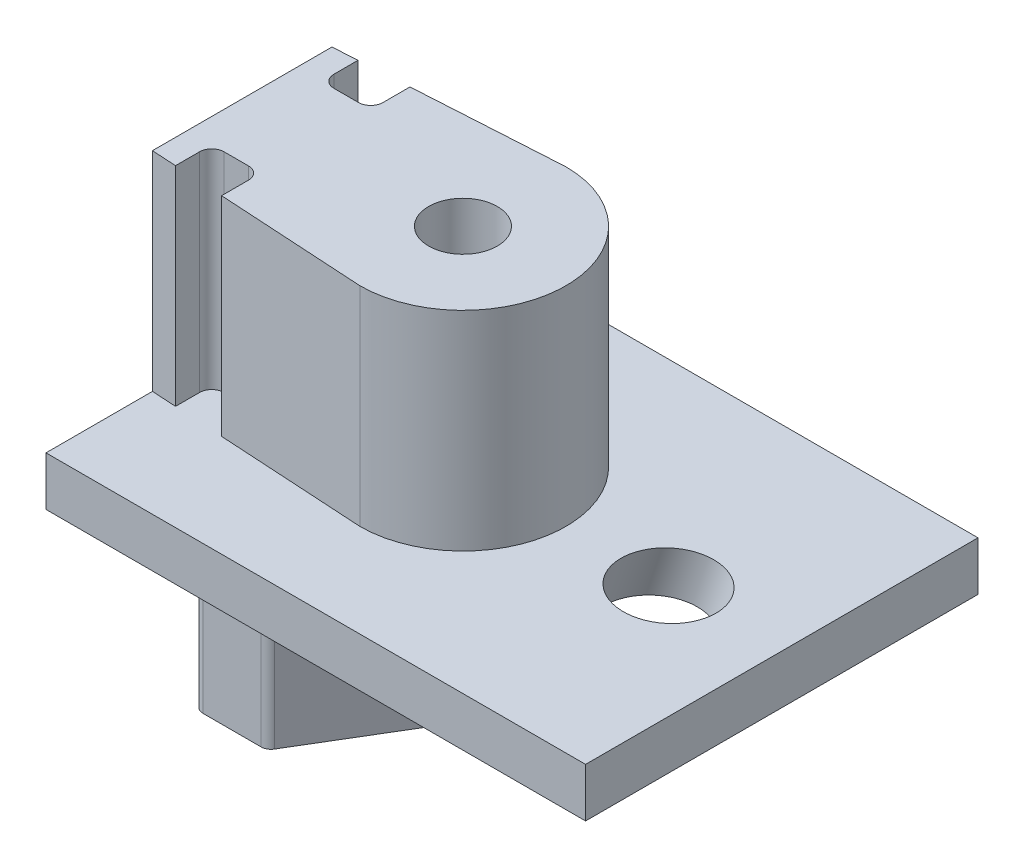
from build123d import *

# Parameters (mm, degrees)
BOSS_EXTRUDE1_DEPTH     = 2.125
SKETCH4_R               = 0.35
THROUGH_HOLES_DEPTH     = 4.445014514
FILLET1_R               = 0.125
SKETCH5_R               = 0.125
BOSS_EXTRUDE2_DEPTH     = 0.5
SKETCH8_R               = 0.46
CUT_EXTRUDE1_DEPTH      = 5.582575695
CUT_EXTRUDE2_DEPTH      = 5.367851302
CUT_EXTRUDE2_DEPTH_BACK = 5.367851302
SKETCH9_W               = 1.465031661
SKETCH9_H               = 4
BOSS_EXTRUDE3_DEPTH     = 1.75
FILLET2_R               = 0.1


with BuildPart() as part:
    # Sketch3 → Boss-Extrude1 (new body)
    with BuildSketch(Plane(origin=(0, 0, 0), x_dir=(1, 0, 0), z_dir=(0, 1, 0))):
        with BuildLine():
            Line((-2.5, 0.9), (-2, 0.93))
            Line((-2, 0.93), (-2, 0.56))
            Line((-2, 0.56), (-1.5, 0.56))
            Line((-1.5, 0.56), (-1.5, 0.96))
            Line((-1.5, 0.96), (0, 1.05))
            ThreePointArc((0, 1.05), (1.05, 0), (0, -1.05))
            Line((0, -1.05), (-1.5, -0.96))
            Line((-1.5, -0.96), (-1.5, -0.56))
            Line((-1.5, -0.56), (-2, -0.56))
            Line((-2, -0.56), (-2, -0.93))
            Line((-2, -0.93), (-2.5, -0.9))
            Line((-2.5, -0.9), (-2.5, 0.9))
        make_face()
    extrude(amount=BOSS_EXTRUDE1_DEPTH)

    # Sketch4 → Through Holes (cut, through all)
    with BuildSketch(Plane(origin=(0, 2.125, 0), x_dir=(1, 0, 0), z_dir=(0, 1, 0))):
        with Locations(Location((0, 0, 0), (0, 0, 270))):
            Circle(SKETCH4_R)
    extrude(amount=-THROUGH_HOLES_DEPTH, mode=Mode.SUBTRACT)

    # Fillet1
    fillet1_edges = [part.edges().sort_by_distance(p)[0] for p in [
        (-2, 1.0625, -0.56),
        (-1.5, 1.0625, -0.56),
        (-1.5, 1.0625, 0.56),
        (-2, 1.0625, 0.56),
    ]]
    fillet(fillet1_edges, radius=FILLET1_R)

    # Sketch5 → Boss-Extrude2 (add)
    with BuildSketch(Plane(origin=(0, 0, 0), x_dir=(1, 0, 0), z_dir=(0, 1, 0))):
        Polygon((-2.25, -2), (1.75, -2), (3.25, -2), (3.25, 2), (1.75, 2), (-2.25, 2), align=None)
        with Locations(Location((0, 0, 0), (0, 0, 270))):
            Circle(SKETCH5_R, mode=Mode.SUBTRACT)
    extrude(amount=-BOSS_EXTRUDE2_DEPTH)

    # Sketch8 → Cut-Extrude1 (cut, through all)
    with BuildSketch(Plane(origin=(0.7, 2.1, 0), x_dir=(0.948683298050514, -0.3162277660168378, 0), z_dir=(0.3162277660168378, 0.948683298050514, 0))):
        with Locations((1.987936011, 0)):
            Circle(SKETCH8_R)
    extrude(amount=-CUT_EXTRUDE1_DEPTH, mode=Mode.SUBTRACT)

    # Sketch9 → Cut-Extrude2 (cut, two sides: drawn at the far end of the back side and taken through both)
    with BuildSketch(Plane.XZ.offset(-CUT_EXTRUDE2_DEPTH_BACK)):
        with Locations((-2.982515831, 0)):
            Rectangle(SKETCH9_W, SKETCH9_H)
    extrude(amount=CUT_EXTRUDE2_DEPTH + CUT_EXTRUDE2_DEPTH_BACK, mode=Mode.SUBTRACT)

    # Sketch10 → Boss-Extrude3 (add)
    with BuildSketch(Plane.XZ.offset(0.5)):
        Polygon((-1.5, 1.25), (-1.5, -1.25), (-0.75, -1.25), (0, 0), (-0.75, 1.25), align=None)
    extrude(amount=BOSS_EXTRUDE3_DEPTH)

    # Fillet2
    fillet2_edges = [part.edges().sort_by_distance(p)[0] for p in [
        (-0.75, -1.375, 1.25),
        (-1.5, -1.375, 1.25),
        (-1.5, -1.375, -1.25),
        (-0.75, -1.375, -1.25),
        (0, -1.375, 0),
    ]]
    fillet(fillet2_edges, radius=FILLET2_R)


solid = part.part
